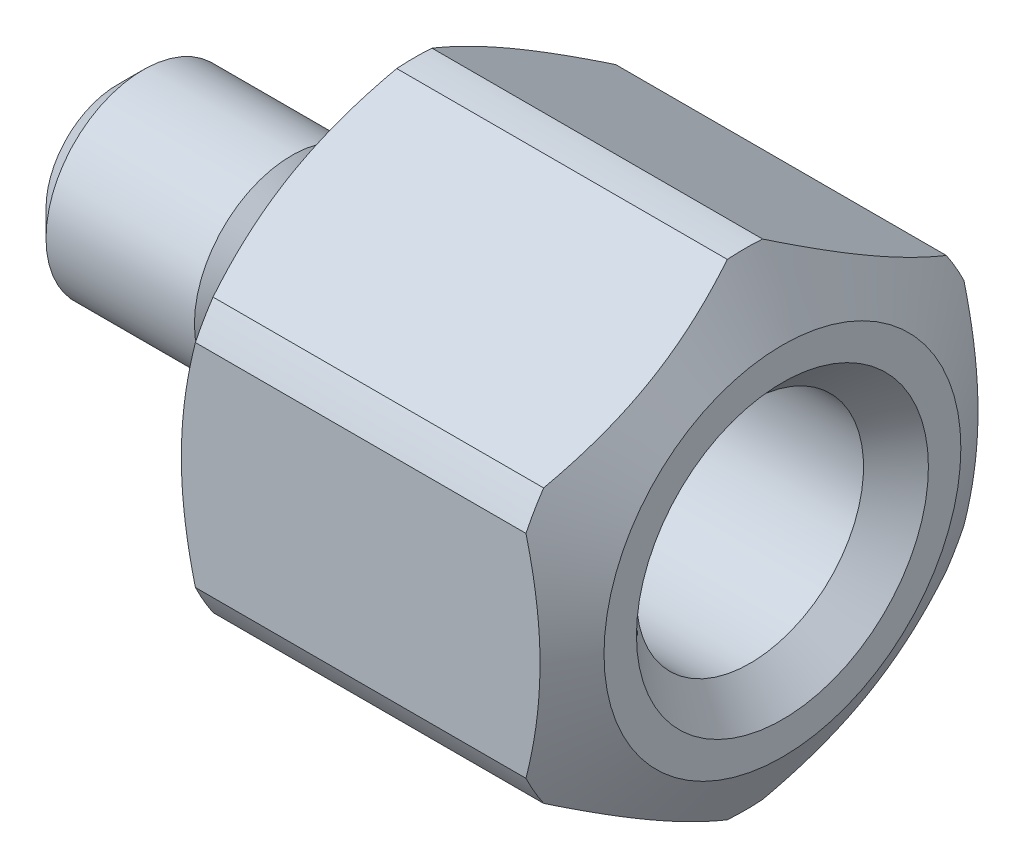
from build123d import *

# Parameters (mm, degrees)
SKETCH_2_OUTSIDE_W  = 43.8
SKETCH_2_OUTSIDE_H  = 43.8
CUT_EXTRUDE_1_DEPTH = 47.16275555


with BuildPart() as part:
    # Эскиз1 → Повернуть1 (revolve)
    with BuildSketch(Plane.XY, mode=Mode.PRIVATE) as revolve_1_sk:
        with BuildLine():
            Line((0, 2), (0, 4.4))
            Line((0, 4.4), (1.6, 6))
            Line((1.6, 6), (10.75, 6))
            Line((10.75, 6), (11.853553391, 4.896446609))
            ThreePointArc((11.853553391, 4.896446609), (12.015765065, 4.788060234), (12.207106781, 4.75))
            Line((12.207106781, 4.75), (15, 4.75))
            ThreePointArc((15, 4.75), (15.707106781, 5.042893219), (16, 5.75))
            Line((16, 5.75), (16, 11))
            Line((16, 11), (18.309401077, 15))
            Line((18.309401077, 15), (38.690598923, 15))
            Line((38.690598923, 15), (41, 11))
            Line((41, 11), (41, 9))
            Line((41, 9), (39, 7))
            Line((39, 7), (26.5, 7))
            Line((26.5, 7), (25.146446609, 8.353553391))
            ThreePointArc((25.146446609, 8.353553391), (24.984234935, 8.461939766), (24.792893219, 8.5))
            Line((24.792893219, 8.5), (22, 8.5))
            ThreePointArc((22, 8.5), (21.292893219, 8.207106781), (21, 7.5))
            Line((21, 7.5), (21, 4))
            Line((21, 4), (19, 2))
            Line((19, 2), (0, 2))
        make_face()
    revolve(revolve_1_sk.sketch.rotate(Axis((0, 0, 0), (1, 0, 0)), 90), axis=Axis((0, 0, 0), (1, 0, 0)))

    # Эскиз2 outside → Вырез-Вытянуть1 (cut, through all)
    with BuildSketch(Plane(origin=(41, 0, 0), x_dir=(0, 0, -1), z_dir=(1, 0, 0))):
        Rectangle(SKETCH_2_OUTSIDE_W, SKETCH_2_OUTSIDE_H)
        Polygon((0, 15.588457268), (-13.5, 7.794228634), (-13.5, -7.794228634), (0, -15.588457268), (13.5, -7.794228634), (13.5, 7.794228634), align=None, mode=Mode.SUBTRACT)
    extrude(amount=-CUT_EXTRUDE_1_DEPTH, mode=Mode.SUBTRACT)


solid = part.part
